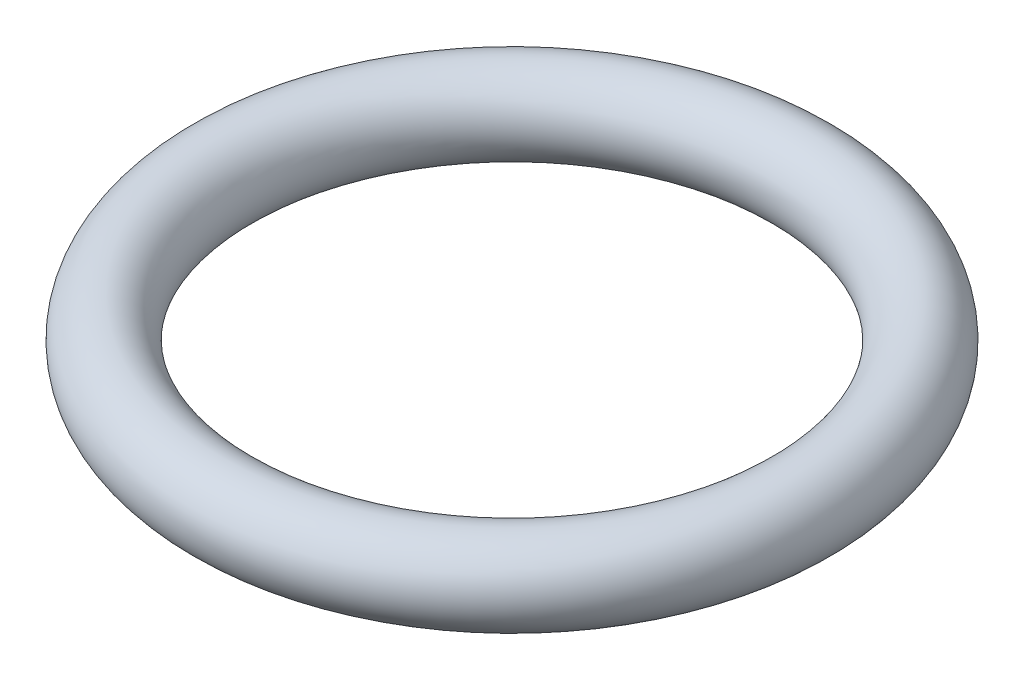
from build123d import *

# Parameters (mm, degrees)
SKETCH3_R = 0.889


with BuildPart() as part:
    # Sketch3 → Revolve2 (revolve)
    with BuildSketch(Plane.XY, mode=Mode.PRIVATE) as revolve2_sk:
        with Locations((6.2992, 20.361)):
            Circle(SKETCH3_R)
    revolve(revolve2_sk.sketch.rotate(Axis((0, 21.25, 0), (0, -1, 0)), 270), axis=Axis((0, 21.25, 0), (0, -1, 0)))


solid = part.part
